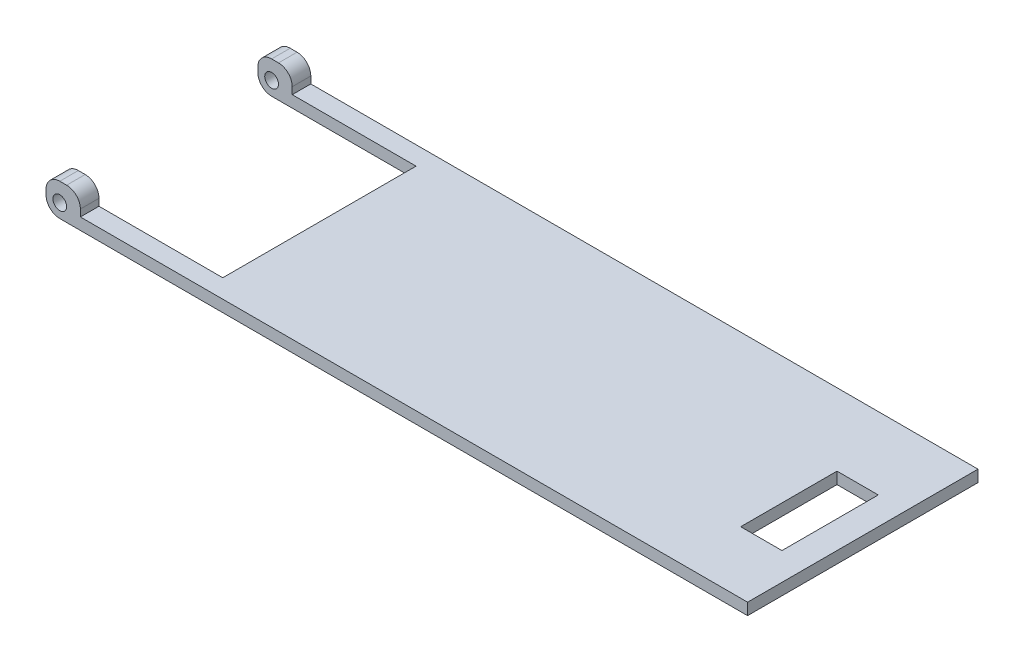
from build123d import *

# Parameters (mm, degrees)
SKETCH1_W            = 102
SKETCH1_H            = 33.5
BOSS_EXTRUDE1_DEPTH  = 1.7
SKETCH2_W            = 23
SKETCH2_H            = 28.1
CUT_EXTRUDE1_DEPTH   = 1.7
SKETCH4_W            = 5
SKETCH4_H            = 2.7
BOSS_EXTRUDE2_DEPTH  = 3
SKETCH5_R            = 1
CUT_EXTRUDE2_DEPTH   = 2.7
FILLET1_R            = 2
FILLET1_OF_MIRROR2_R = 2
SKETCH10_W           = 6
SKETCH10_H           = 14
CUT_EXTRUDE3_DEPTH   = 1.7


with BuildPart() as part:
    # Sketch1 → Boss-Extrude1 (new body)
    with BuildSketch(Plane(origin=(0, 0, 0), x_dir=(1, 0, 0), z_dir=(0, 1, 0))):
        Rectangle(SKETCH1_W, SKETCH1_H)
    extrude(amount=BOSS_EXTRUDE1_DEPTH)

    # Sketch2 → Cut-Extrude1 (cut)
    with BuildSketch(Plane(origin=(0, 1.7, 0), x_dir=(1, 0, 0), z_dir=(0, 1, 0))):
        with Locations((-39.5, 0)):
            Rectangle(SKETCH2_W, SKETCH2_H)
    extrude(amount=-CUT_EXTRUDE1_DEPTH, mode=Mode.SUBTRACT)

    # Sketch4 → Boss-Extrude2 (add)
    with BuildSketch(Plane(origin=(0, 1.7, 0), x_dir=(1, 0, 0), z_dir=(0, 1, 0))):
        with Locations((-48.5, -15.4)):
            Rectangle(SKETCH4_W, SKETCH4_H)
    boss_extrude2 = extrude(amount=BOSS_EXTRUDE2_DEPTH)

    # Sketch5 → Cut-Extrude2 (cut)
    with BuildSketch(Plane.XY.offset(16.75)):
        with Locations((-49, 2)):
            Circle(SKETCH5_R)
    cut_extrude2 = extrude(amount=-CUT_EXTRUDE2_DEPTH, mode=Mode.SUBTRACT)

    # Fillet1
    fillet1_edges = [part.edges().sort_by_distance(p)[0] for p in [
        (-51, 0, 15.4),
        (-51, 4.7, 15.4),
        (-46, 4.7, 15.4),
    ]]
    fillet(fillet1_edges, radius=FILLET1_R)

    # Mirror2: Boss-Extrude2, Cut-Extrude2 across plane
    add(boss_extrude2.mirror(Plane.XY))
    add(cut_extrude2.mirror(Plane.XY), mode=Mode.SUBTRACT)

    # Fillet1 of Mirror2
    fillet1_of_mirror2_edges = [part.edges().sort_by_distance(p)[0] for p in [
        (-51, 0, -15.4),
        (-51, 4.7, -15.4),
        (-46, 4.7, -15.4),
    ]]
    fillet(fillet1_of_mirror2_edges, radius=FILLET1_OF_MIRROR2_R)

    # Sketch10 → Cut-Extrude3 (cut)
    with BuildSketch(Plane(origin=(0, 1.7, 0), x_dir=(1, 0, 0), z_dir=(0, 1, 0))):
        with Locations((44, -0.75)):
            Rectangle(SKETCH10_W, SKETCH10_H)
    extrude(amount=-CUT_EXTRUDE3_DEPTH, mode=Mode.SUBTRACT)


solid = part.part
